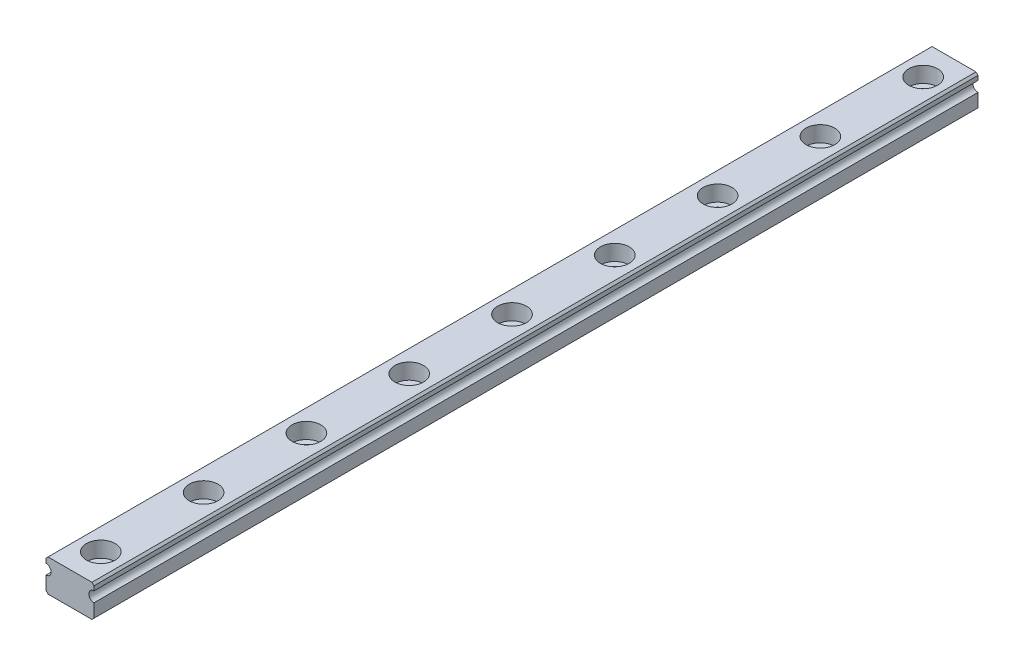
from build123d import *

# Parameters (mm, degrees)
BOSS_EXTRUDE1_DEPTH = 129


with BuildPart() as part:
    # Sketch1 → Boss-Extrude1 (new body)
    with BuildSketch(Plane.XY):
        with BuildLine():
            Line((-3.5, 4.403015152), (-3.5, 3.76))
            ThreePointArc((-3.5, 3.76), (-2.75, 3.01), (-3.5, 2.26))
            Line((-3.5, 2.26), (-3.5, 0.3))
            Line((-3.5, 0.3), (-3.2, 0))
            Line((-3.2, 0), (3.2, 0))
            Line((3.2, 0), (3.5, 0.3))
            Line((3.5, 0.3), (3.5, 2.26))
            ThreePointArc((3.5, 2.26), (2.75, 3.01), (3.5, 3.76))
            Line((3.5, 3.76), (3.5, 4.403015152))
            Line((3.5, 4.403015152), (3.203015152, 4.7))
            Line((3.203015152, 4.7), (-3.203015152, 4.7))
            Line((-3.203015152, 4.7), (-3.5, 4.403015152))
        make_face()
    extrude(amount=BOSS_EXTRUDE1_DEPTH)

    # Sketch2 → Cut-Revolve1 (revolve, cut)
    with BuildSketch(Plane(origin=(0, 0, 0), x_dir=(0, 0, -1), z_dir=(1, 0, 0)), mode=Mode.PRIVATE) as cut_revolve1_sk:
        Polygon((-4.5, 4.7), (-2.4, 4.7), (-2.4, 2.4), (-3.3, 2.4), (-3.3, 0), (-4.5, 0), align=None)
    revolve(cut_revolve1_sk.sketch.rotate(Axis((0, 0, 4.5), (0, 1, 0)), 180), axis=Axis((0, 0, 4.5), (0, 1, 0)), mode=Mode.SUBTRACT)

    # Sketch3 → Cut-Revolve2 (revolve, cut)
    with BuildSketch(Plane(origin=(0, 0, 0), x_dir=(0, 0, -1), z_dir=(1, 0, 0)), mode=Mode.PRIVATE) as cut_revolve2_sk:
        Polygon((-124.5, 4.7), (-122.4, 4.7), (-122.4, 2.4), (-123.3, 2.4), (-123.3, 0), (-124.5, 0), align=None)
    revolve(cut_revolve2_sk.sketch.rotate(Axis((0, 0, 124.5), (0, 1, 0)), 180), axis=Axis((0, 0, 124.5), (0, 1, 0)), mode=Mode.SUBTRACT)

    # Sketch4 → Cut-Revolve3 (revolve, cut)
    with BuildSketch(Plane(origin=(0, 0, 0), x_dir=(0, 0, -1), z_dir=(1, 0, 0)), mode=Mode.PRIVATE) as cut_revolve3_sk:
        Polygon((-109.5, 4.7), (-107.4, 4.7), (-107.4, 2.4), (-108.3, 2.4), (-108.3, 0), (-109.5, 0), align=None)
    revolve(cut_revolve3_sk.sketch.rotate(Axis((0, 0, 109.5), (0, 1, 0)), 180), axis=Axis((0, 0, 109.5), (0, 1, 0)), mode=Mode.SUBTRACT)

    # Sketch5 → Cut-Revolve4 (revolve, cut)
    with BuildSketch(Plane(origin=(0, 0, 0), x_dir=(0, 0, -1), z_dir=(1, 0, 0)), mode=Mode.PRIVATE) as cut_revolve4_sk:
        Polygon((-94.5, 4.7), (-92.4, 4.7), (-92.4, 2.4), (-93.3, 2.4), (-93.3, 0), (-94.5, 0), align=None)
    revolve(cut_revolve4_sk.sketch.rotate(Axis((0, 0, 94.5), (0, 1, 0)), 180), axis=Axis((0, 0, 94.5), (0, 1, 0)), mode=Mode.SUBTRACT)

    # Sketch6 → Cut-Revolve5 (revolve, cut)
    with BuildSketch(Plane(origin=(0, 0, 0), x_dir=(0, 0, -1), z_dir=(1, 0, 0)), mode=Mode.PRIVATE) as cut_revolve5_sk:
        Polygon((-79.5, 4.7), (-77.4, 4.7), (-77.4, 2.4), (-78.3, 2.4), (-78.3, 0), (-79.5, 0), align=None)
    revolve(cut_revolve5_sk.sketch.rotate(Axis((0, 0, 79.5), (0, 1, 0)), 180), axis=Axis((0, 0, 79.5), (0, 1, 0)), mode=Mode.SUBTRACT)

    # Sketch7 → Cut-Revolve6 (revolve, cut)
    with BuildSketch(Plane(origin=(0, 0, 0), x_dir=(0, 0, -1), z_dir=(1, 0, 0)), mode=Mode.PRIVATE) as cut_revolve6_sk:
        Polygon((-64.5, 4.7), (-62.4, 4.7), (-62.4, 2.4), (-63.3, 2.4), (-63.3, 0), (-64.5, 0), align=None)
    revolve(cut_revolve6_sk.sketch.rotate(Axis((0, 0, 64.5), (0, 1, 0)), 180), axis=Axis((0, 0, 64.5), (0, 1, 0)), mode=Mode.SUBTRACT)

    # Sketch8 → Cut-Revolve7 (revolve, cut)
    with BuildSketch(Plane(origin=(0, 0, 0), x_dir=(0, 0, -1), z_dir=(1, 0, 0)), mode=Mode.PRIVATE) as cut_revolve7_sk:
        Polygon((-49.5, 4.7), (-47.4, 4.7), (-47.4, 2.4), (-48.3, 2.4), (-48.3, 0), (-49.5, 0), align=None)
    revolve(cut_revolve7_sk.sketch.rotate(Axis((0, 0, 49.5), (0, 1, 0)), 180), axis=Axis((0, 0, 49.5), (0, 1, 0)), mode=Mode.SUBTRACT)

    # Sketch9 → Cut-Revolve8 (revolve, cut)
    with BuildSketch(Plane(origin=(0, 0, 0), x_dir=(0, 0, -1), z_dir=(1, 0, 0)), mode=Mode.PRIVATE) as cut_revolve8_sk:
        Polygon((-34.5, 4.7), (-32.4, 4.7), (-32.4, 2.4), (-33.3, 2.4), (-33.3, 0), (-34.5, 0), align=None)
    revolve(cut_revolve8_sk.sketch.rotate(Axis((0, 0, 34.5), (0, 1, 0)), 180), axis=Axis((0, 0, 34.5), (0, 1, 0)), mode=Mode.SUBTRACT)

    # Sketch10 → Cut-Revolve9 (revolve, cut)
    with BuildSketch(Plane(origin=(0, 0, 0), x_dir=(0, 0, -1), z_dir=(1, 0, 0)), mode=Mode.PRIVATE) as cut_revolve9_sk:
        Polygon((-19.5, 4.7), (-17.4, 4.7), (-17.4, 2.4), (-18.3, 2.4), (-18.3, 0), (-19.5, 0), align=None)
    revolve(cut_revolve9_sk.sketch.rotate(Axis((0, 0, 19.5), (0, 1, 0)), 180), axis=Axis((0, 0, 19.5), (0, 1, 0)), mode=Mode.SUBTRACT)


solid = part.part
